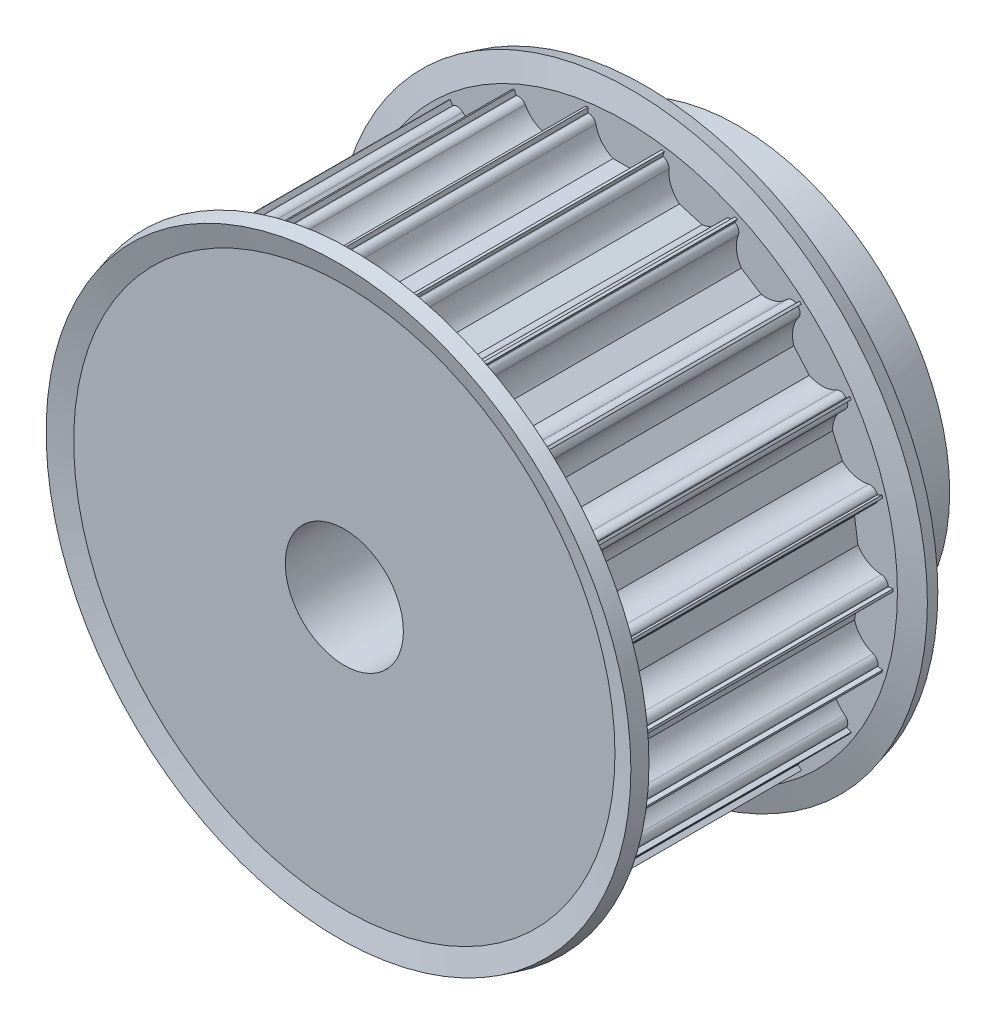
from build123d import *

# Parameters (mm, degrees)
CUT_EXTRUDE1_DEPTH = 56.543901555
CIRPATTERN1_COUNT  = 22


with BuildPart() as part:
    # Sketch1 → Revolve1 (revolve)
    with BuildSketch(Plane(origin=(0, 0, 0), x_dir=(0, 0, -1), z_dir=(1, 0, 0)), mode=Mode.PRIVATE) as revolve1_sk:
        Polygon((0, 6), (0, 27.25), (30, 27.25), (30, 21.5), (40, 21.5), (40, 6), align=None)
    revolve(revolve1_sk.sketch.rotate(Axis((0, 0, 55), (0, 0, -1)), 90), axis=Axis((0, 0, 55), (0, 0, -1)))

    # Sketch2 → Cut-Extrude1 (cut, through all)
    with BuildSketch(Plane.XY):
        with BuildLine():
            Line((3.674234614, 26.5), (3.75, 26.5))
            Line((3.75, 26.5), (3.75, 28.5))
            Line((3.75, 28.5), (-3.75, 28.5))
            Line((-3.75, 28.5), (-3.75, 26.5))
            Line((-3.75, 26.5), (-3.674234614, 26.5))
            ThreePointArc((-3.674234614, 26.5), (-3.199892965, 26.330947502), (-2.939387691, 25.9))
            ThreePointArc((-2.939387691, 25.9), (-2.331759211, 24.612435701), (-1.198957881, 23.75))
            Line((-1.198957881, 23.75), (1.198957881, 23.75))
            ThreePointArc((1.198957881, 23.75), (2.331759211, 24.612435701), (2.939387691, 25.9))
            ThreePointArc((2.939387691, 25.9), (3.199892965, 26.330947502), (3.674234614, 26.5))
        make_face()
    cut_extrude1 = extrude(amount=-CUT_EXTRUDE1_DEPTH, mode=Mode.SUBTRACT)

    # CirPattern1: Cut-Extrude1 ×22 about axis
    cirpattern1_axis = Axis((0, 0, 0), (0, 0, 1))
    for i in range(1, CIRPATTERN1_COUNT):
        add(cut_extrude1.rotate(cirpattern1_axis, i * 360 / CIRPATTERN1_COUNT), mode=Mode.SUBTRACT)

    # Sketch3 → Revolve2 (revolve)
    with BuildSketch(Plane(origin=(0, 0, 0), x_dir=(0, 0, -1), z_dir=(1, 0, 0)), mode=Mode.PRIVATE) as revolve2_sk:
        Polygon((0, 27.493260406), (0, 22.690739153), (1.5, 22.690739153), (1.5, 27.690739153), (0.856921938, 30.090739153), (-0.591966801, 29.702510585), align=None)
        Polygon((30.591966801, 29.702510585), (29.143078062, 30.090739153), (28.5, 27.690739153), (28.5, 22.690739153), (30, 22.690739153), (30, 27.493260406), align=None)
    revolve(revolve2_sk.sketch.rotate(Axis((0, 0, 55), (0, 0, -1)), 90), axis=Axis((0, 0, 55), (0, 0, -1)))


solid = part.part
